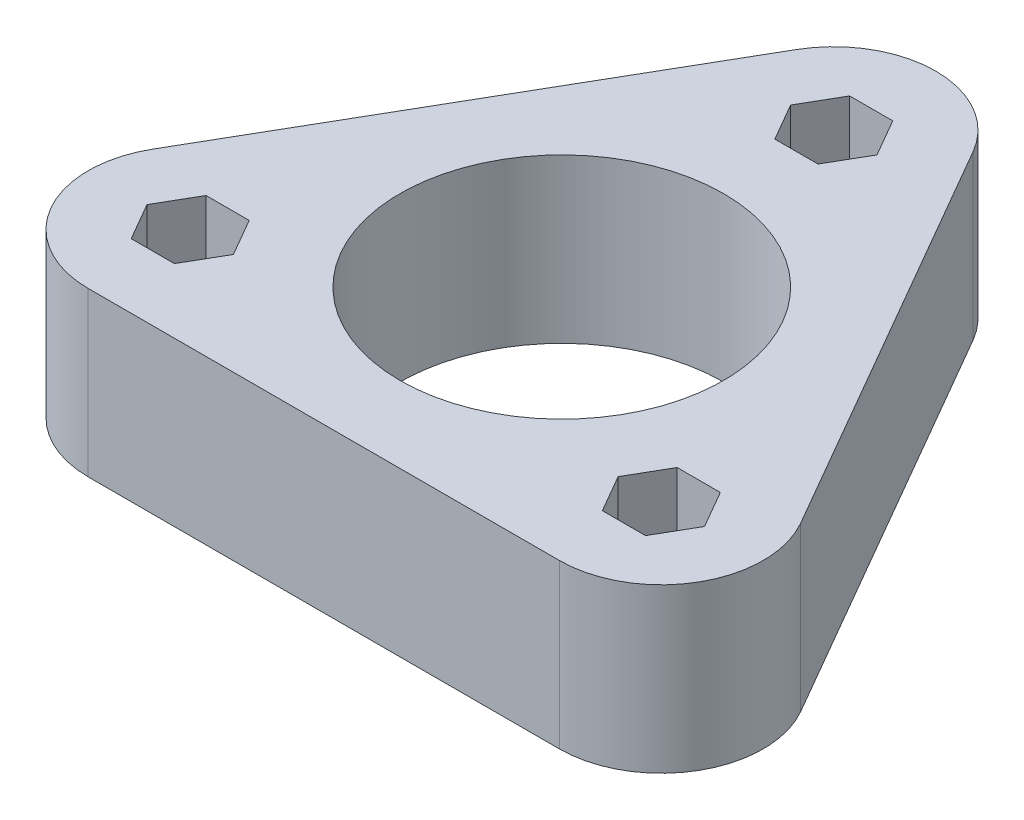
from build123d import *

# Parameters (mm, degrees)
ESQUISSE1_R             = 11.9
ESQUISSE1_R_2           = 1.5
BOSS_EXTRU_1_DEPTH      = 12
ENL_V_MAT_EXTRU_1_DEPTH = 5


with BuildPart() as part:
    # Esquisse1 → Boss.-Extru.1 (new body)
    with BuildSketch(Plane(origin=(0, 0, 0), x_dir=(1, 0, 0), z_dir=(0, 1, 0))):
        with BuildLine():
            Line((-6.495190528, 23.75), (-23.815698604, -6.25))
            ThreePointArc((-23.815698604, -6.25), (-23.815698604, -13.75), (-17.320508076, -17.5))
            Line((-17.320508076, -17.5), (17.320508076, -17.5))
            ThreePointArc((17.320508076, -17.5), (23.815698604, -13.75), (23.815698604, -6.25))
            Line((23.815698604, -6.25), (6.495190528, 23.75))
            ThreePointArc((6.495190528, 23.75), (0, 27.5), (-6.495190528, 23.75))
        make_face()
        with Locations(Location((0, 0, 0), (0, 0, 270))):
            Circle(ESQUISSE1_R, mode=Mode.SUBTRACT)
        with Locations(Location((-17.320508076, -10, 0), (0, 0, 270))):
            Circle(ESQUISSE1_R_2, mode=Mode.SUBTRACT)
        with Locations(Location((0, 20, 0), (0, 0, 270))):
            Circle(ESQUISSE1_R_2, mode=Mode.SUBTRACT)
        with Locations(Location((17.320508076, -10, 0), (0, 0, 270))):
            Circle(ESQUISSE1_R_2, mode=Mode.SUBTRACT)
    extrude(amount=BOSS_EXTRU_1_DEPTH)

    # Esquisse2 → Enlèv. mat.-Extru.1 (cut)
    with BuildSketch(Plane(origin=(0, 12, 0), x_dir=(1, 0, 0), z_dir=(0, 1, 0))):
        Polygon((-18.908221316, -7.25), (-20.495934556, -10), (-18.908221316, -12.75), (-15.732794835, -12.75), (-14.145081595, -10), (-15.732794835, -7.25), align=None)
        Polygon((-1.58771324, 22.75), (-3.175426481, 20), (-1.58771324, 17.25), (1.58771324, 17.25), (3.175426481, 20), (1.58771324, 22.75), align=None)
        Polygon((18.908221316, -7.25), (15.732794835, -7.25), (14.145081595, -10), (15.732794835, -12.75), (18.908221316, -12.75), (20.495934556, -10), align=None)
    extrude(amount=-ENL_V_MAT_EXTRU_1_DEPTH, mode=Mode.SUBTRACT)


solid = part.part
